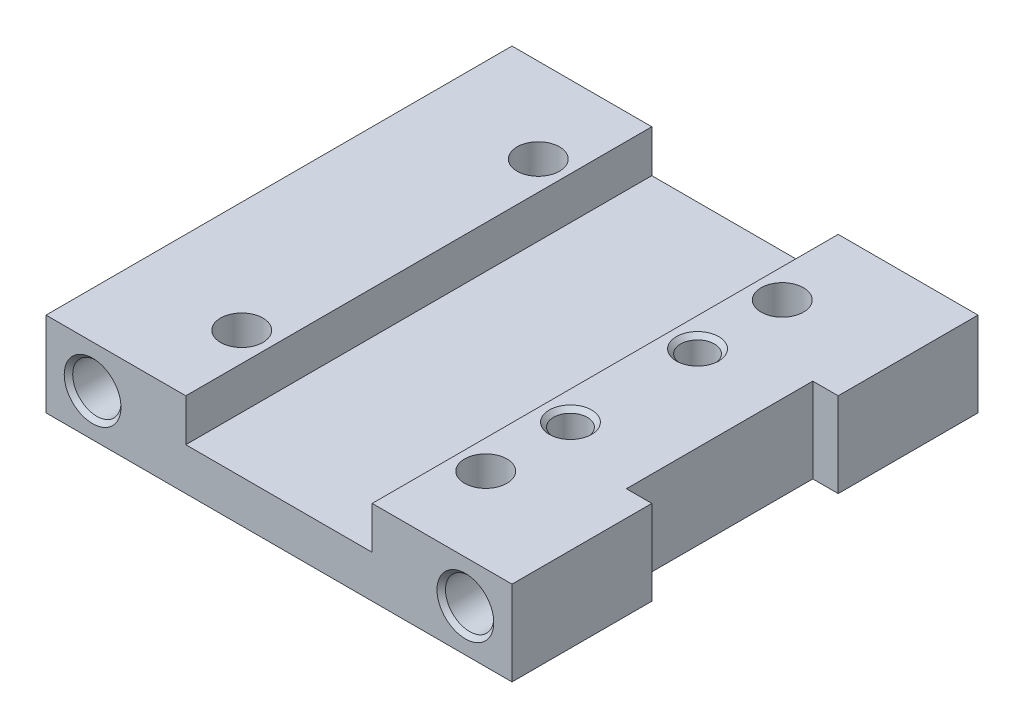
from build123d import *

# Parameters (mm, degrees)
SKETCH1_R           = 2.5
SKETCH1_R_2         = 2
BOSS_EXTRUDE1_DEPTH = 5
SKETCH2_R           = 2.85
CUT_EXTRUDE1_DEPTH  = 8
CHAMFER1_SIZE       = 0.5
SKETCH3_W           = 22
SKETCH3_H           = 55
CUT_EXTRUDE2_DEPTH  = 5


with BuildPart() as part:
    # Sketch1 → Boss-Extrude1 (new, symmetric)
    with BuildSketch(Plane(origin=(0, 0, 0), x_dir=(1, 0, 0), z_dir=(0, 1, 0))):
        Polygon((27.5, 27.5), (-27.5, 27.5), (-27.5, -27.5), (27.5, -27.5), (27.5, -11), (24.5, -11), (24.5, 11), (27.5, 11), align=None)
        with Locations(Location((-14.4, -17.5, 0), (0, 0, 270))):
            Circle(SKETCH1_R, mode=Mode.SUBTRACT)
        with Locations(Location((14.4, -17.5, 0), (0, 0, 270))):
            Circle(SKETCH1_R, mode=Mode.SUBTRACT)
        with Locations(Location((14.4, -7.5, 0), (0, 0, 270))):
            Circle(SKETCH1_R_2, mode=Mode.SUBTRACT)
        with Locations(Location((-14.4, 17.5, 0), (0, 0, 270))):
            Circle(SKETCH1_R, mode=Mode.SUBTRACT)
        with Locations(Location((14.4, 7.5, 0), (0, 0, 270))):
            Circle(SKETCH1_R_2, mode=Mode.SUBTRACT)
        with Locations(Location((14.4, 17.5, 0), (0, 0, 270))):
            Circle(SKETCH1_R, mode=Mode.SUBTRACT)
    extrude(amount=BOSS_EXTRUDE1_DEPTH, both=True)

    # Sketch2 → Cut-Extrude1 (cut)
    with BuildSketch(Plane.XY.offset(27.5)):
        with Locations((-22, 0)):
            Circle(SKETCH2_R)
        with Locations(Location((22, 0, 0), (0, 0, 180))):
            Circle(SKETCH2_R)
    cut_extrude1 = extrude(amount=-CUT_EXTRUDE1_DEPTH, mode=Mode.SUBTRACT)

    # Mirror1: Cut-Extrude1 across plane
    add(cut_extrude1.mirror(Plane.XY), mode=Mode.SUBTRACT)

    # Chamfer1
    chamfer1_edges = [part.edges().sort_by_distance(p)[0] for p in [
        (14.4, 5, 5.5),
        (14.4, 5, -9.5),
        (-24.85, 0, 27.5),
        (24.85, 0, 27.5),
        (-24.85, 0, -27.5),
        (24.85, 0, -27.5),
    ]]
    chamfer(chamfer1_edges, length=CHAMFER1_SIZE)

    # Sketch3 → Cut-Extrude2 (cut)
    with BuildSketch(Plane(origin=(0, 5, 0), x_dir=(1, 0, 0), z_dir=(0, 1, 0))):
        Rectangle(SKETCH3_W, SKETCH3_H)
    extrude(amount=-CUT_EXTRUDE2_DEPTH, mode=Mode.SUBTRACT)


solid = part.part
